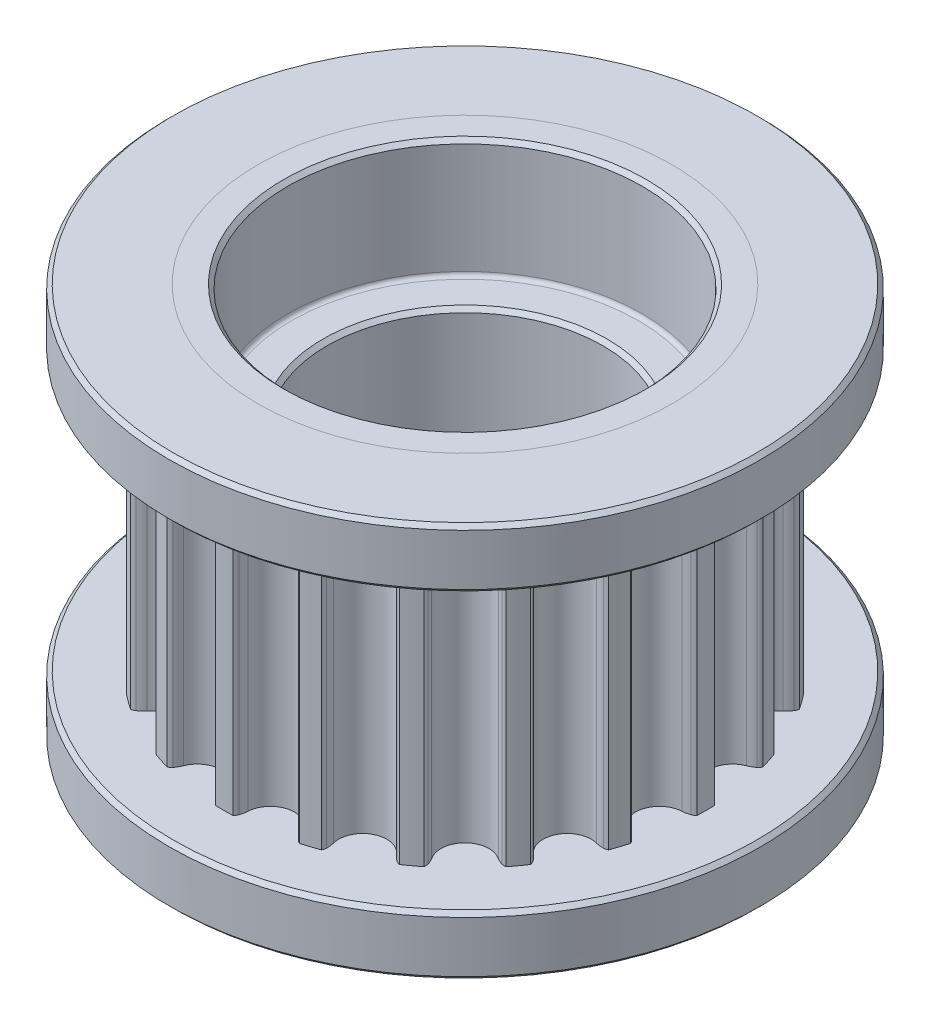
from build123d import *

# Parameters (mm, degrees)
ZKOSEN_1_SIZE            = 0.1
ZAOBLIT1_R               = 0.1
SKICA11_OUTSIDE_W        = 18.214
SKICA11_OUTSIDE_H        = 18.214
ODEBRAT_VYSUNUT_M1_DEPTH = 13.120816804
SKICA10_R                = 7.5
SKICA10_R_2              = 5.25
P_IDAT_VYSUNUT_M1_DEPTH  = 1.5
SKICA12_R                = 7.5
SKICA12_R_2              = 5.25
P_IDAT_VYSUNUT_M2_DEPTH  = 1.5
ZKOSEN_2_SIZE            = 0.1
ZKOSEN_3_SIZE            = 0.1


with BuildPart() as part:
    # Skica1 → Rotovat1 (revolve)
    with BuildSketch(Plane.XY, mode=Mode.PRIVATE) as rotovat1_sk:
        Polygon((4.5, 10), (5.25, 10), (5.25, 8.5), (6.11, 8.5), (6.11, 1.5), (5.25, 1.5), (5.25, 0), (4.5, 0), (4.5, 3), (3.5, 3), (3.5, 7), (4.5, 7), align=None)
    revolve(rotovat1_sk.sketch.rotate(Axis((0, 0, 0), (0, -1, 0)), 90), axis=Axis((0, 0, 0), (0, -1, 0)))

    # Zkosení1
    zkosen_1_edges = [part.edges().sort_by_distance(p)[0] for p in [
        (0, 3, -3.5),
        (0, 0, -4.5),
        (0, 10, -4.5),
        (0, 7, -3.5),
    ]]
    chamfer(zkosen_1_edges, length=ZKOSEN_1_SIZE)

    # Zaoblit1
    zaoblit1_edges = [part.edges().sort_by_distance(p)[0] for p in [
        (0, 3, -4.5),
        (0, 7, -4.5),
    ]]
    fillet(zaoblit1_edges, radius=ZAOBLIT1_R)

    # Skica11 outside → Odebrat vysunutím1 (cut, through all)
    with BuildSketch(Plane(origin=(0, 8.5, 0), x_dir=(1, 0, 0), z_dir=(0, 1, 0))):
        Rectangle(SKICA11_OUTSIDE_W, SKICA11_OUTSIDE_H)
        with BuildLine():
            ThreePointArc((-3.682382953, -4.525571141), (-3.762727315, -3.762727315), (-4.525571141, -3.682382953))
            ThreePointArc((-4.525571141, -3.682382953), (-4.610021183, -3.728793285), (-4.700326133, -3.762419831))
            ThreePointArc((-4.700326133, -3.762419831), (-4.754288274, -3.771323603), (-4.808820948, -3.767154999))
            ThreePointArc((-4.808820948, -3.767154999), (-4.942042114, -3.590603771), (-5.068784705, -3.409345583))
            ThreePointArc((-5.068784705, -3.409345583), (-5.05589776, -3.356193758), (-5.030754552, -3.307624129))
            ThreePointArc((-5.030754552, -3.307624129), (-4.970868041, -3.232130193), (-4.900632695, -3.166155011))
            ThreePointArc((-4.900632695, -3.166155011), (-4.741313017, -2.415819646), (-5.441992836, -2.103675911))
            ThreePointArc((-5.441992836, -2.103675911), (-5.53665118, -2.121718261), (-5.632927465, -2.125793243))
            ThreePointArc((-5.632927465, -2.125793243), (-5.686999927, -2.117586015), (-5.737575413, -2.096769914))
            ThreePointArc((-5.737575413, -2.096769914), (-5.809718941, -1.887692114), (-5.874246448, -1.676139718))
            ThreePointArc((-5.874246448, -1.676139718), (-5.845565418, -1.629571614), (-5.806643965, -1.591148831))
            ThreePointArc((-5.806643965, -1.591148831), (-5.7263596, -1.53785578), (-5.639174364, -1.496813569))
            ThreePointArc((-5.639174364, -1.496813569), (-5.255785967, -0.832434719), (-5.825714356, -0.319046414))
            ThreePointArc((-5.825714356, -0.319046414), (-5.921315183, -0.306954671), (-6.01413861, -0.281079202))
            ThreePointArc((-6.01413861, -0.281079202), (-6.063028405, -0.256564354), (-6.104696021, -0.221138381))
            ThreePointArc((-6.104696021, -0.221138381), (-6.1087, 0), (-6.104696021, 0.221138381))
            ThreePointArc((-6.104696021, 0.221138381), (-6.063028405, 0.256564354), (-6.01413861, 0.281079202))
            ThreePointArc((-6.01413861, 0.281079202), (-5.921315183, 0.306954671), (-5.825714356, 0.319046414))
            ThreePointArc((-5.825714356, 0.319046414), (-5.255785967, 0.832434719), (-5.639174364, 1.496813569))
            ThreePointArc((-5.639174364, 1.496813569), (-5.7263596, 1.53785578), (-5.806643965, 1.591148831))
            ThreePointArc((-5.806643965, 1.591148831), (-5.845565418, 1.629571614), (-5.874246448, 1.676139718))
            ThreePointArc((-5.874246448, 1.676139718), (-5.809718941, 1.887692114), (-5.737575413, 2.096769914))
            ThreePointArc((-5.737575413, 2.096769914), (-5.686999927, 2.117586015), (-5.632927465, 2.125793243))
            ThreePointArc((-5.632927465, 2.125793243), (-5.53665118, 2.121718261), (-5.441992836, 2.103675911))
            ThreePointArc((-5.441992836, 2.103675911), (-4.741313017, 2.415819646), (-4.900632695, 3.166155011))
            ThreePointArc((-4.900632695, 3.166155011), (-4.970868041, 3.232130193), (-5.030754552, 3.307624129))
            ThreePointArc((-5.030754552, 3.307624129), (-5.05589776, 3.356193758), (-5.068784705, 3.409345583))
            ThreePointArc((-5.068784705, 3.409345583), (-4.942042114, 3.590603771), (-4.808820948, 3.767154999))
            ThreePointArc((-4.808820948, 3.767154999), (-4.754288274, 3.771323603), (-4.700326133, 3.762419831))
            ThreePointArc((-4.700326133, 3.762419831), (-4.610021183, 3.728793285), (-4.525571141, 3.682382953))
            ThreePointArc((-4.525571141, 3.682382953), (-3.762727315, 3.762727315), (-3.682382953, 4.525571141))
            ThreePointArc((-3.682382953, 4.525571141), (-3.728793285, 4.610021183), (-3.762419831, 4.700326133))
            ThreePointArc((-3.762419831, 4.700326133), (-3.771323603, 4.754288274), (-3.767154999, 4.808820948))
            ThreePointArc((-3.767154999, 4.808820948), (-3.590603771, 4.942042114), (-3.409345583, 5.068784705))
            ThreePointArc((-3.409345583, 5.068784705), (-3.356193758, 5.05589776), (-3.307624129, 5.030754552))
            ThreePointArc((-3.307624129, 5.030754552), (-3.232130193, 4.970868041), (-3.166155011, 4.900632695))
            ThreePointArc((-3.166155011, 4.900632695), (-2.415819646, 4.741313017), (-2.103675911, 5.441992836))
            ThreePointArc((-2.103675911, 5.441992836), (-2.121718261, 5.53665118), (-2.125793243, 5.632927465))
            ThreePointArc((-2.125793243, 5.632927465), (-2.117586015, 5.686999927), (-2.096769914, 5.737575413))
            ThreePointArc((-2.096769914, 5.737575413), (-1.887692114, 5.809718941), (-1.676139718, 5.874246448))
            ThreePointArc((-1.676139718, 5.874246448), (-1.629571614, 5.845565418), (-1.591148831, 5.806643965))
            ThreePointArc((-1.591148831, 5.806643965), (-1.53785578, 5.7263596), (-1.496813569, 5.639174364))
            ThreePointArc((-1.496813569, 5.639174364), (-0.832434719, 5.255785967), (-0.319046414, 5.825714356))
            ThreePointArc((-0.319046414, 5.825714356), (-0.306954671, 5.921315183), (-0.281079202, 6.01413861))
            ThreePointArc((-0.281079202, 6.01413861), (-0.256564354, 6.063028405), (-0.221138381, 6.104696021))
            ThreePointArc((-0.221138381, 6.104696021), (0, 6.1087), (0.221138381, 6.104696021))
            ThreePointArc((0.221138381, 6.104696021), (0.256564354, 6.063028405), (0.281079202, 6.01413861))
            ThreePointArc((0.281079202, 6.01413861), (0.306954671, 5.921315183), (0.319046414, 5.825714356))
            ThreePointArc((0.319046414, 5.825714356), (0.832434719, 5.255785967), (1.496813569, 5.639174364))
            ThreePointArc((1.496813569, 5.639174364), (1.53785578, 5.7263596), (1.591148831, 5.806643965))
            ThreePointArc((1.591148831, 5.806643965), (1.629571614, 5.845565418), (1.676139718, 5.874246448))
            ThreePointArc((1.676139718, 5.874246448), (1.887692114, 5.809718941), (2.096769914, 5.737575413))
            ThreePointArc((2.096769914, 5.737575413), (2.117586015, 5.686999927), (2.125793243, 5.632927465))
            ThreePointArc((2.125793243, 5.632927465), (2.121718261, 5.53665118), (2.103675911, 5.441992836))
            ThreePointArc((2.103675911, 5.441992836), (2.415819646, 4.741313017), (3.166155011, 4.900632695))
            ThreePointArc((3.166155011, 4.900632695), (3.232130193, 4.970868041), (3.307624129, 5.030754552))
            ThreePointArc((3.307624129, 5.030754552), (3.356193758, 5.05589776), (3.409345583, 5.068784705))
            ThreePointArc((3.409345583, 5.068784705), (3.590603771, 4.942042114), (3.767154999, 4.808820948))
            ThreePointArc((3.767154999, 4.808820948), (3.771323603, 4.754288274), (3.762419831, 4.700326133))
            ThreePointArc((3.762419831, 4.700326133), (3.728793285, 4.610021183), (3.682382953, 4.525571141))
            ThreePointArc((3.682382953, 4.525571141), (3.762727315, 3.762727315), (4.525571141, 3.682382953))
            ThreePointArc((4.525571141, 3.682382953), (4.610021183, 3.728793285), (4.700326133, 3.762419831))
            ThreePointArc((4.700326133, 3.762419831), (4.754288273, 3.771323603), (4.808820948, 3.767154999))
            ThreePointArc((4.808820948, 3.767154999), (4.942042114, 3.590603771), (5.068784705, 3.409345583))
            ThreePointArc((5.068784705, 3.409345583), (5.05589776, 3.356193758), (5.030754552, 3.307624129))
            ThreePointArc((5.030754552, 3.307624129), (4.970868041, 3.232130193), (4.900632695, 3.166155011))
            ThreePointArc((4.900632695, 3.166155011), (4.741313017, 2.415819646), (5.441992836, 2.103675911))
            ThreePointArc((5.441992836, 2.103675911), (5.53665118, 2.121718261), (5.632927465, 2.125793243))
            ThreePointArc((5.632927465, 2.125793243), (5.686999927, 2.117586015), (5.737575413, 2.096769914))
            ThreePointArc((5.737575413, 2.096769914), (5.809718941, 1.887692114), (5.874246448, 1.676139718))
            ThreePointArc((5.874246448, 1.676139718), (5.845565418, 1.629571614), (5.806643965, 1.591148831))
            ThreePointArc((5.806643965, 1.591148831), (5.7263596, 1.53785578), (5.639174364, 1.496813569))
            ThreePointArc((5.639174364, 1.496813569), (5.255785967, 0.832434719), (5.825714356, 0.319046414))
            ThreePointArc((5.825714356, 0.319046414), (5.921315183, 0.306954671), (6.01413861, 0.281079202))
            ThreePointArc((6.01413861, 0.281079202), (6.063028405, 0.256564354), (6.104696021, 0.221138381))
            ThreePointArc((6.104696021, 0.221138381), (6.1087, 0), (6.104696021, -0.221138381))
            ThreePointArc((6.104696021, -0.221138381), (6.063028405, -0.256564354), (6.01413861, -0.281079202))
            ThreePointArc((6.01413861, -0.281079202), (5.921315183, -0.306954671), (5.825714356, -0.319046414))
            ThreePointArc((5.825714356, -0.319046414), (5.255785967, -0.832434719), (5.639174364, -1.496813569))
            ThreePointArc((5.639174364, -1.496813569), (5.7263596, -1.53785578), (5.806643965, -1.591148831))
            ThreePointArc((5.806643965, -1.591148831), (5.845565418, -1.629571614), (5.874246448, -1.676139718))
            ThreePointArc((5.874246448, -1.676139718), (5.809718941, -1.887692114), (5.737575413, -2.096769914))
            ThreePointArc((5.737575413, -2.096769914), (5.686999927, -2.117586015), (5.632927465, -2.125793243))
            ThreePointArc((5.632927465, -2.125793243), (5.53665118, -2.121718261), (5.441992836, -2.103675911))
            ThreePointArc((5.441992836, -2.103675911), (4.741313017, -2.415819646), (4.900632695, -3.166155011))
            ThreePointArc((4.900632695, -3.166155011), (4.970868041, -3.232130193), (5.030754552, -3.307624129))
            ThreePointArc((5.030754552, -3.307624129), (5.05589776, -3.356193758), (5.068784705, -3.409345583))
            ThreePointArc((5.068784705, -3.409345583), (4.942042114, -3.590603771), (4.808820948, -3.767154999))
            ThreePointArc((4.808820948, -3.767154999), (4.754288273, -3.771323603), (4.700326133, -3.762419831))
            ThreePointArc((4.700326133, -3.762419831), (4.610021183, -3.728793285), (4.525571141, -3.682382953))
            ThreePointArc((4.525571141, -3.682382953), (3.762727315, -3.762727315), (3.682382953, -4.525571141))
            ThreePointArc((3.682382953, -4.525571141), (3.728793285, -4.610021183), (3.762419831, -4.700326133))
            ThreePointArc((3.762419831, -4.700326133), (3.771323603, -4.754288274), (3.767154999, -4.808820948))
            ThreePointArc((3.767154999, -4.808820948), (3.590603771, -4.942042114), (3.409345583, -5.068784705))
            ThreePointArc((3.409345583, -5.068784705), (3.356193758, -5.05589776), (3.307624129, -5.030754552))
            ThreePointArc((3.307624129, -5.030754552), (3.232130193, -4.970868041), (3.166155011, -4.900632695))
            ThreePointArc((3.166155011, -4.900632695), (2.415819646, -4.741313017), (2.103675911, -5.441992836))
            ThreePointArc((2.103675911, -5.441992836), (2.121718261, -5.53665118), (2.125793243, -5.632927465))
            ThreePointArc((2.125793243, -5.632927465), (2.117586015, -5.686999927), (2.096769914, -5.737575413))
            ThreePointArc((2.096769914, -5.737575413), (1.887692114, -5.809718941), (1.676139718, -5.874246448))
            ThreePointArc((1.676139718, -5.874246448), (1.629571614, -5.845565418), (1.591148831, -5.806643965))
            ThreePointArc((1.591148831, -5.806643965), (1.53785578, -5.7263596), (1.496813569, -5.639174364))
            ThreePointArc((1.496813569, -5.639174364), (0.832434719, -5.255785967), (0.319046414, -5.825714356))
            ThreePointArc((0.319046414, -5.825714356), (0.306954671, -5.921315183), (0.281079202, -6.01413861))
            ThreePointArc((0.281079202, -6.01413861), (0.256564354, -6.063028405), (0.221138381, -6.104696021))
            ThreePointArc((0.221138381, -6.104696021), (0, -6.1087), (-0.221138381, -6.104696021))
            ThreePointArc((-0.221138381, -6.104696021), (-0.256564354, -6.063028405), (-0.281079202, -6.01413861))
            ThreePointArc((-0.281079202, -6.01413861), (-0.306954671, -5.921315183), (-0.319046414, -5.825714356))
            ThreePointArc((-0.319046414, -5.825714356), (-0.832434719, -5.255785967), (-1.496813569, -5.639174364))
            ThreePointArc((-1.496813569, -5.639174364), (-1.53785578, -5.7263596), (-1.591148831, -5.806643965))
            ThreePointArc((-1.591148831, -5.806643965), (-1.629571614, -5.845565418), (-1.676139718, -5.874246448))
            ThreePointArc((-1.676139718, -5.874246448), (-1.887692114, -5.809718941), (-2.096769914, -5.737575413))
            ThreePointArc((-2.096769914, -5.737575413), (-2.117586015, -5.686999927), (-2.125793243, -5.632927465))
            ThreePointArc((-2.125793243, -5.632927465), (-2.121718261, -5.53665118), (-2.103675911, -5.441992836))
            ThreePointArc((-2.103675911, -5.441992836), (-2.415819646, -4.741313017), (-3.166155011, -4.900632695))
            ThreePointArc((-3.166155011, -4.900632695), (-3.232130193, -4.970868041), (-3.307624129, -5.030754552))
            ThreePointArc((-3.307624129, -5.030754552), (-3.356193758, -5.05589776), (-3.409345583, -5.068784705))
            ThreePointArc((-3.409345583, -5.068784705), (-3.590603771, -4.942042114), (-3.767154999, -4.808820948))
            ThreePointArc((-3.767154999, -4.808820948), (-3.771323603, -4.754288274), (-3.762419831, -4.700326133))
            ThreePointArc((-3.762419831, -4.700326133), (-3.728793285, -4.610021183), (-3.682382953, -4.525571141))
        make_face(mode=Mode.SUBTRACT)
    extrude(amount=-ODEBRAT_VYSUNUT_M1_DEPTH, mode=Mode.SUBTRACT)


with BuildPart() as body_2:
    # Skica10 → Přidat vysunutím1 (new body)
    with BuildSketch(Plane(origin=(0, 10, 0), x_dir=(1, 0, 0), z_dir=(0, 1, 0))):
        with Locations(Location((0, 0, 0), (0, 0, 270))):
            Circle(SKICA10_R)
        with Locations(Location((0, 0, 0), (0, 0, 270))):
            Circle(SKICA10_R_2, mode=Mode.SUBTRACT)
    extrude(amount=-P_IDAT_VYSUNUT_M1_DEPTH)

    # Zkosení2
    zkosen_2_edges = [body_2.edges().sort_by_distance(p)[0] for p in [
        (0, 10, -7.5),
        (0, 8.5, -7.5),
    ]]
    chamfer(zkosen_2_edges, length=ZKOSEN_2_SIZE)


with BuildPart() as body_3:
    # Skica12 → Přidat vysunutím2 (new body)
    with BuildSketch(Plane.XZ):
        with Locations(Location((0, 0, 0), (0, 0, 270))):
            Circle(SKICA12_R)
        with Locations(Location((0, 0, 0), (0, 0, 270))):
            Circle(SKICA12_R_2, mode=Mode.SUBTRACT)
    extrude(amount=-P_IDAT_VYSUNUT_M2_DEPTH)

    # Zkosení3
    zkosen_3_edges = [body_3.edges().sort_by_distance(p)[0] for p in [
        (0, 0, 7.5),
        (0, 1.5, 7.5),
    ]]
    chamfer(zkosen_3_edges, length=ZKOSEN_3_SIZE)


solid = Compound([part.part, body_2.part, body_3.part])
